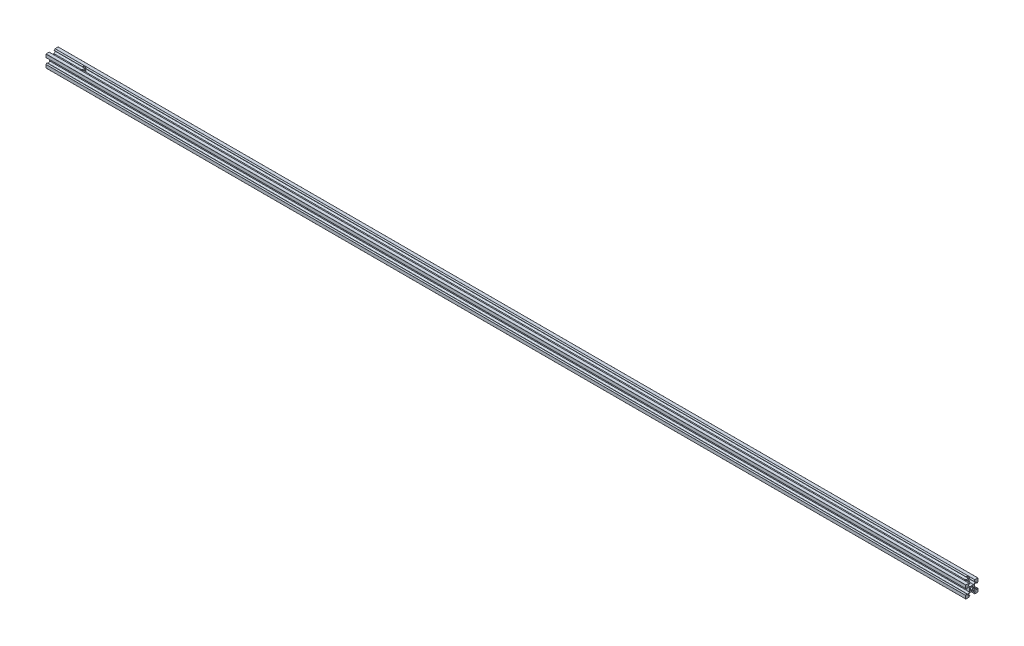
from build123d import *

# Parameters (mm, degrees)
BOSS_EXTRUDE3_DEPTH     = 1500
SKETCH20_R              = 2
CUT_EXTRUDE5_DEPTH      = 1501.066665185
CHAMFER1_SIZE           = 0.5
FILLET2_R               = 0.2
CUT_EXTRUDE6_REACH      = 1502.099
SKETCH21_R              = 1.65
CUT_EXTRUDE7_DEPTH      = 1501.098663422
CUT_EXTRUDE7_DEPTH_BACK = 1501.098663422
SKETCH23_R              = 2.25
SKETCH25_R              = 4.5
CUT_EXTRUDE8_DEPTH      = 7


with BuildPart() as part:
    # Sketch19 → Boss-Extrude3 (new body)
    with BuildSketch(Plane(origin=(0, 0, 0), x_dir=(0, 0, -1), z_dir=(1, 0, 0))):
        with BuildLine():
            Line((-3.341421356, 8.541421356), (-4.8, 10))
            Line((-4.8, 10), (-10, 10))
            Line((-10, 10), (-10, 4.8))
            Line((-10, 4.8), (-8.541421356, 3.341421356))
            ThreePointArc((-8.541421356, 3.341421356), (-8.323463314, 3.298066806), (-8.2, 3.482842712))
            Line((-8.2, 3.482842712), (-8.2, 5.2))
            Line((-8.2, 5.2), (-6.2, 5.2))
            Line((-6.2, 5.2), (-4, 3))
            Line((-4, 3), (-4, -3))
            Line((-4, -3), (-6.2, -5.2))
            Line((-6.2, -5.2), (-8.2, -5.2))
            Line((-8.2, -5.2), (-8.2, -3.482842712))
            ThreePointArc((-8.2, -3.482842712), (-8.323463314, -3.298066806), (-8.541421356, -3.341421356))
            Line((-8.541421356, -3.341421356), (-10, -4.8))
            Line((-10, -4.8), (-10, -10))
            Line((-10, -10), (-4.8, -10))
            Line((-4.8, -10), (-3.341421356, -8.541421356))
            ThreePointArc((-3.341421356, -8.541421356), (-3.298066806, -8.323463314), (-3.482842712, -8.2))
            Line((-3.482842712, -8.2), (-5.2, -8.2))
            Line((-5.2, -8.2), (-5.2, -6.2))
            Line((-5.2, -6.2), (-3, -4))
            Line((-3, -4), (3, -4))
            Line((3, -4), (5.2, -6.2))
            Line((5.2, -6.2), (5.2, -8.2))
            Line((5.2, -8.2), (3.482842712, -8.2))
            ThreePointArc((3.482842712, -8.2), (3.298066806, -8.323463314), (3.341421356, -8.541421356))
            Line((3.341421356, -8.541421356), (4.8, -10))
            Line((4.8, -10), (10, -10))
            Line((10, -10), (10, -4.8))
            Line((10, -4.8), (8.541421356, -3.341421356))
            ThreePointArc((8.541421356, -3.341421356), (8.323463314, -3.298066806), (8.2, -3.482842712))
            Line((8.2, -3.482842712), (8.2, -5.2))
            Line((8.2, -5.2), (6.2, -5.2))
            Line((6.2, -5.2), (4, -3))
            Line((4, -3), (4, 3))
            Line((4, 3), (6.2, 5.2))
            Line((6.2, 5.2), (8.2, 5.2))
            Line((8.2, 5.2), (8.2, 3.482842712))
            ThreePointArc((8.2, 3.482842712), (8.323463314, 3.298066806), (8.541421356, 3.341421356))
            Line((8.541421356, 3.341421356), (10, 4.8))
            Line((10, 4.8), (10, 10))
            Line((10, 10), (4.8, 10))
            Line((4.8, 10), (3.341421356, 8.541421356))
            ThreePointArc((3.341421356, 8.541421356), (3.298066806, 8.323463314), (3.482842712, 8.2))
            Line((3.482842712, 8.2), (5.2, 8.2))
            Line((5.2, 8.2), (5.2, 6.2))
            Line((5.2, 6.2), (3, 4))
            Line((3, 4), (-3, 4))
            Line((-3, 4), (-5.2, 6.2))
            Line((-5.2, 6.2), (-5.2, 8.2))
            Line((-5.2, 8.2), (-3.482842712, 8.2))
            ThreePointArc((-3.482842712, 8.2), (-3.298066806, 8.323463314), (-3.341421356, 8.541421356))
        make_face()
    extrude(amount=BOSS_EXTRUDE3_DEPTH)

    # Sketch20 → Cut-Extrude5 (cut, through all)
    with BuildSketch(Plane(origin=(1500, 0, 0), x_dir=(0, 0, -1), z_dir=(1, 0, 0))):
        Circle(SKETCH20_R)
    extrude(amount=-CUT_EXTRUDE5_DEPTH, mode=Mode.SUBTRACT)

    # Chamfer1
    chamfer1_edges = [part.edges().sort_by_distance(p)[0] for p in [
        (0, 0, 2),
        (1500, 0, 2),
    ]]
    chamfer(chamfer1_edges, length=CHAMFER1_SIZE)

    # Fillet2
    fillet2_edges = [part.edges().sort_by_distance(p)[0] for p in [
        (750, 4.8, 10),
        (750, 10, 10),
        (750, 10, 4.8),
        (750, 10, -4.8),
        (750, 10, -10),
        (750, 4.8, -10),
        (750, -4.8, -10),
        (750, -10, -10),
        (750, -10, -4.8),
        (750, -10, 4.8),
        (750, -10, 10),
        (750, -4.8, 10),
    ]]
    fillet(fillet2_edges, radius=FILLET2_R)

    # Cut-Extrude6: up to this face of the body (flat: up to its plane)
    cut_extrude6_end = Plane(part.part.faces().sort_by_distance((750, -4, 0))[0])
    # Sketch21 → Cut-Extrude6 (cut, up to the picked face)
    with BuildSketch(Plane(origin=(0, 4, 0), x_dir=(1, 0, 0), z_dir=(0, 1, 0)), mode=Mode.PRIVATE) as cut_extrude6_sk1:
        with Locations(Location((3, 0, 0), (0, 0, 270))):
            Circle(SKETCH21_R)
    cut_extrude6_tool1 = split(extrude(cut_extrude6_sk1.sketch, amount=-CUT_EXTRUDE6_REACH, mode=Mode.PRIVATE), bisect_by=cut_extrude6_end, keep=Keep.BOTH, mode=Mode.PRIVATE)
    # Sketch21 → Cut-Extrude6 (cut, up to the picked face)
    with BuildSketch(Plane(origin=(0, 4, 0), x_dir=(1, 0, 0), z_dir=(0, 1, 0)), mode=Mode.PRIVATE) as cut_extrude6_sk2:
        with Locations(Location((29, 0, 0), (0, 0, 270))):
            Circle(SKETCH21_R)
    cut_extrude6_tool2 = split(extrude(cut_extrude6_sk2.sketch, amount=-CUT_EXTRUDE6_REACH, mode=Mode.PRIVATE), bisect_by=cut_extrude6_end, keep=Keep.BOTH, mode=Mode.PRIVATE)
    add(cut_extrude6_tool1.solids().sort_by(Axis((3, 4, 0), (0, -1, 0)))[0], mode=Mode.SUBTRACT)
    add(cut_extrude6_tool2.solids().sort_by(Axis((29, 4, 0), (0, -1, 0)))[0], mode=Mode.SUBTRACT)

    # Sketch23 → Cut-Extrude7 (cut, two sides: drawn at the far end of the back side and taken through both)
    with BuildSketch(Plane(origin=(0, 4, 0), x_dir=(1, 0, 0), z_dir=(0, 1, 0)).offset(-CUT_EXTRUDE7_DEPTH_BACK)):
        with Locations(Location((49, 0, 0), (0, 0, 270))):
            Circle(SKETCH23_R)
        with Locations(Location((1490, 0, 0), (0, 0, 270))):
            Circle(SKETCH23_R)
    extrude(amount=CUT_EXTRUDE7_DEPTH + CUT_EXTRUDE7_DEPTH_BACK, mode=Mode.SUBTRACT)

    # Sketch25 → Cut-Extrude8 (cut)
    with BuildSketch(Plane(origin=(0, 10, 0), x_dir=(1, 0, 0), z_dir=(0, 1, 0))):
        with Locations(Location((1490, 0, 0), (0, 0, 297.266044451))):
            Circle(SKETCH25_R)
        with Locations(Location((49, 0, 0), (0, 0, 242.733955549))):
            Circle(SKETCH25_R)
    extrude(amount=-CUT_EXTRUDE8_DEPTH, mode=Mode.SUBTRACT)


solid = part.part
